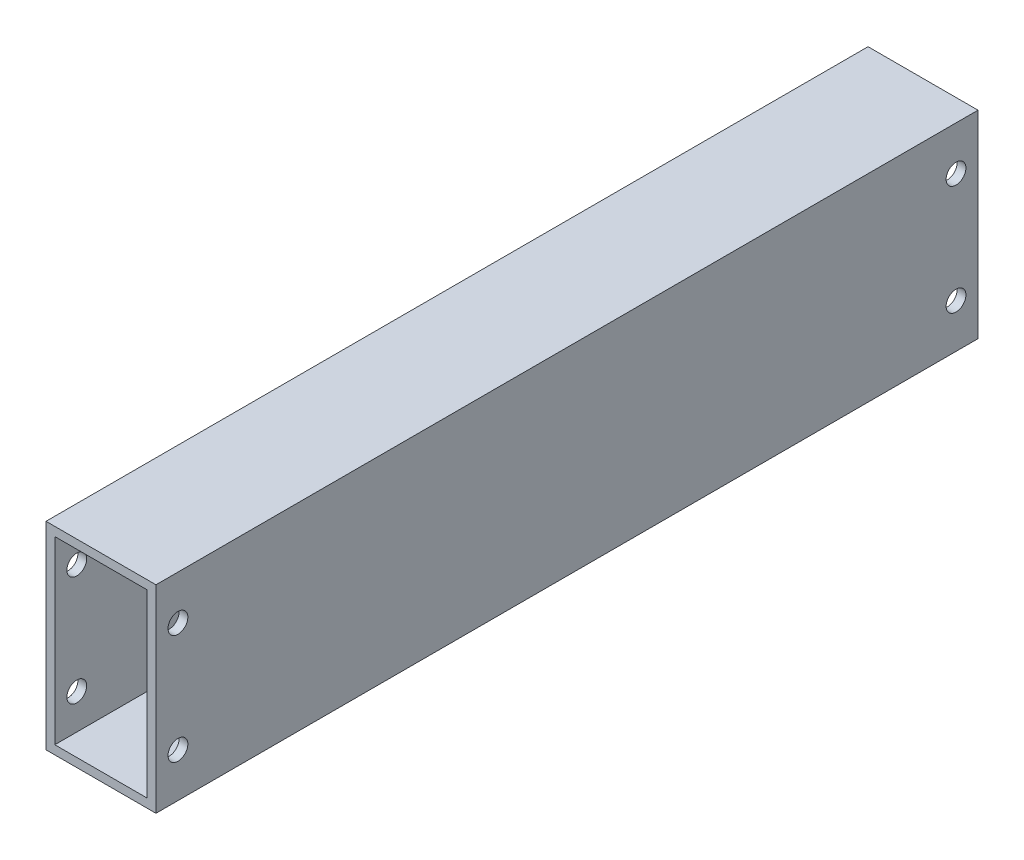
from build123d import *

# Parameters (mm, degrees)
SKETCH1_W            = 25
SKETCH1_H            = 45
SKETCH1_W_2          = 21
SKETCH1_H_2          = 41
BOSS_EXTRUDE1_DEPTH  = 186.9
M4_CLEARANCE_HOLE1_D = 4.5


with BuildPart() as part:
    # Sketch1 → Boss-Extrude1 (new body)
    with BuildSketch(Plane.XY.offset(40)):
        Rectangle(SKETCH1_W, SKETCH1_H)
        Rectangle(SKETCH1_W_2, SKETCH1_H_2, mode=Mode.SUBTRACT)
    extrude(amount=BOSS_EXTRUDE1_DEPTH)

    # M4 Clearance Hole1 (through all)
    with Locations(Plane(origin=(12.5, 0, 0), x_dir=(0, 0, -1), z_dir=(1, 0, 0))):
        with Locations((-45, -12.5), (-45, 12.5), (-221.9, 12.5), (-221.9, -12.5)):
            Hole(M4_CLEARANCE_HOLE1_D / 2)


solid = part.part
